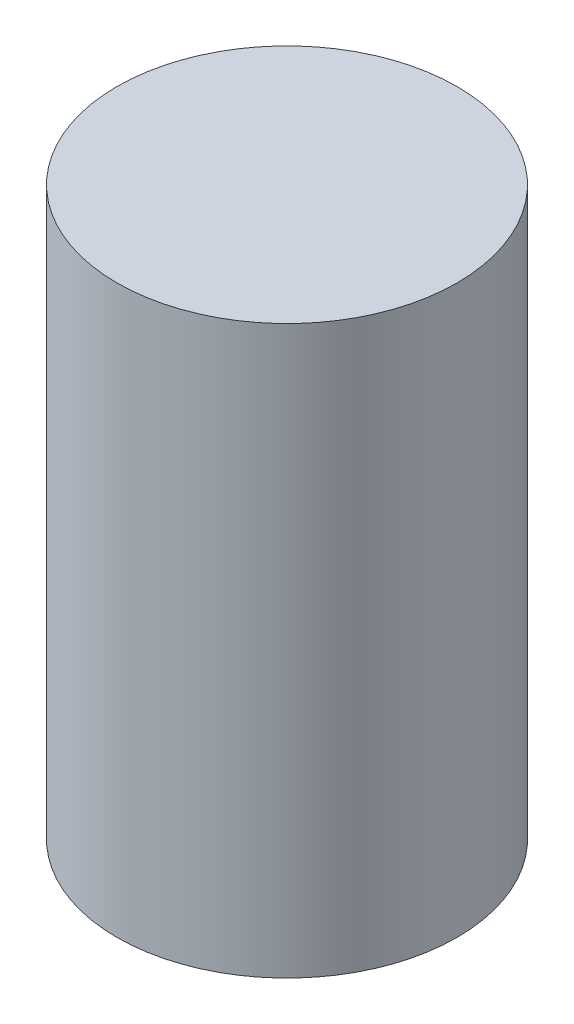
from build123d import *

# Parameters (mm, degrees)
SKETCH1_R           = 3
BOSS_EXTRUDE1_DEPTH = 10


with BuildPart() as part:
    # Sketch1 → Boss-Extrude1 (new body)
    with BuildSketch(Plane(origin=(0, 0, 0), x_dir=(1, 0, 0), z_dir=(0, 1, 0))):
        with Locations(Location((0, 0, 0), (0, 0, 270))):
            Circle(SKETCH1_R)
    extrude(amount=BOSS_EXTRUDE1_DEPTH)


solid = part.part
